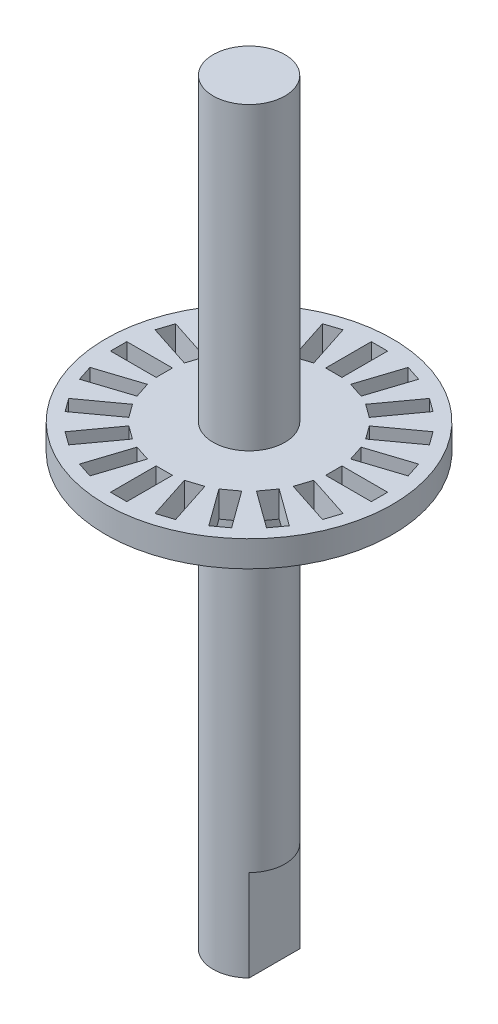
from build123d import *
from build123d.topology import SkipClean

# Parameters (mm, degrees)
SKETCH_1_R      = 2.75
EXTRUDE_1_DEPTH = 51
EXTRUDE_START   = 7
EXTRUDE_2_DEPTH = 7
EXTRUDE_START_2 = -25
SKETCH_6_R      = 11
SKETCH_6_W      = 1.25
SKETCH_6_H      = 3.5
SKETCH_6_W_2    = 3.5
SKETCH_6_H_2    = 1.25
EXTRUDE_4_DEPTH = 2


with BuildPart() as part:
    # 草图1 → 凸台-拉伸1 (new body)
    with BuildSketch(Plane(origin=(0, 0, 0), x_dir=(1, 0, 0), z_dir=(0, 1, 0))):
        Circle(SKETCH_1_R)
    extrude(amount=EXTRUDE_1_DEPTH)

    # 草图2 → 凸台-拉伸2 (add)
    with SkipClean():  # the faces are left unmerged after this step: merging them gives an invalid solid
        with BuildSketch(Plane.XZ.offset(EXTRUDE_START)):
            with BuildLine():
                Line((-1.95, 1.939071943), (-1.95, -1.939071943))
                ThreePointArc((-1.95, -1.939071943), (0, -2.75), (1.95, -1.939071943))
                Line((1.95, -1.939071943), (1.95, 1.939071943))
                ThreePointArc((1.95, 1.939071943), (0, 2.75), (-1.95, 1.939071943))
            make_face()
        extrude(amount=-EXTRUDE_2_DEPTH)

    # 草图6 → 凸台-拉伸4 (add)
    with SkipClean():  # the faces are left unmerged after this step: merging them gives an invalid solid
        with BuildSketch(Plane(origin=(0, 51, 0), x_dir=(1, 0, 0), z_dir=(0, 1, 0)).offset(EXTRUDE_START_2)):
            Circle(SKETCH_6_R)
            Polygon((2.495759621, 9.703700784), (3.684580266, 9.317429541), (2.603020786, 5.988731734), (1.414200141, 6.375002977), align=None, mode=Mode.SUBTRACT)
            with Locations((0, 8.25)):
                Rectangle(SKETCH_6_W, SKETCH_6_H, mode=Mode.SUBTRACT)
            Polygon((5.372216901, 8.457535726), (6.383488144, 7.722804161), (4.326239761, 4.891244681), (3.314968518, 5.625976246), align=None, mode=Mode.SUBTRACT)
            Polygon((7.722804161, 6.383488144), (8.457535726, 5.372216901), (5.625976246, 3.314968518), (4.891244681, 4.326239761), align=None, mode=Mode.SUBTRACT)
            Polygon((9.317429541, 3.684580266), (9.703700784, 2.495759621), (6.375002977, 1.414200141), (5.988731734, 2.603020786), align=None, mode=Mode.SUBTRACT)
            with Locations((8.25, 0)):
                Rectangle(SKETCH_6_W_2, SKETCH_6_H_2, mode=Mode.SUBTRACT)
            Polygon((9.703700784, -2.495759621), (9.317429541, -3.684580266), (5.988731734, -2.603020786), (6.375002977, -1.414200141), align=None, mode=Mode.SUBTRACT)
            Polygon((8.457535726, -5.372216901), (7.722804161, -6.383488144), (4.891244681, -4.326239761), (5.625976246, -3.314968518), align=None, mode=Mode.SUBTRACT)
            Polygon((6.383488144, -7.722804161), (5.372216901, -8.457535726), (3.314968518, -5.625976246), (4.326239761, -4.891244681), align=None, mode=Mode.SUBTRACT)
            Polygon((3.684580266, -9.317429541), (2.495759621, -9.703700784), (1.414200141, -6.375002977), (2.603020786, -5.988731734), align=None, mode=Mode.SUBTRACT)
            with Locations((0, -8.25)):
                Rectangle(SKETCH_6_W, SKETCH_6_H, mode=Mode.SUBTRACT)
            Polygon((-2.495759621, -9.703700784), (-3.684580266, -9.317429541), (-2.603020786, -5.988731734), (-1.414200141, -6.375002977), align=None, mode=Mode.SUBTRACT)
            Polygon((-5.372216901, -8.457535726), (-6.383488144, -7.722804161), (-4.326239761, -4.891244681), (-3.314968518, -5.625976246), align=None, mode=Mode.SUBTRACT)
            Polygon((-7.722804161, -6.383488144), (-8.457535726, -5.372216901), (-5.625976246, -3.314968518), (-4.891244681, -4.326239761), align=None, mode=Mode.SUBTRACT)
            Polygon((-9.317429541, -3.684580266), (-9.703700784, -2.495759621), (-6.375002977, -1.414200141), (-5.988731734, -2.603020786), align=None, mode=Mode.SUBTRACT)
            with Locations((-8.25, 0)):
                Rectangle(SKETCH_6_W_2, SKETCH_6_H_2, mode=Mode.SUBTRACT)
            Polygon((-9.703700784, 2.495759621), (-9.317429541, 3.684580266), (-5.988731734, 2.603020786), (-6.375002977, 1.414200141), align=None, mode=Mode.SUBTRACT)
            Polygon((-8.457535726, 5.372216901), (-7.722804161, 6.383488144), (-4.891244681, 4.326239761), (-5.625976246, 3.314968518), align=None, mode=Mode.SUBTRACT)
            Polygon((-6.383488144, 7.722804161), (-5.372216901, 8.457535726), (-3.314968518, 5.625976246), (-4.326239761, 4.891244681), align=None, mode=Mode.SUBTRACT)
            Polygon((-3.684580266, 9.317429541), (-2.495759621, 9.703700784), (-1.414200141, 6.375002977), (-2.603020786, 5.988731734), align=None, mode=Mode.SUBTRACT)
        extrude(amount=EXTRUDE_4_DEPTH)


solid = part.part
